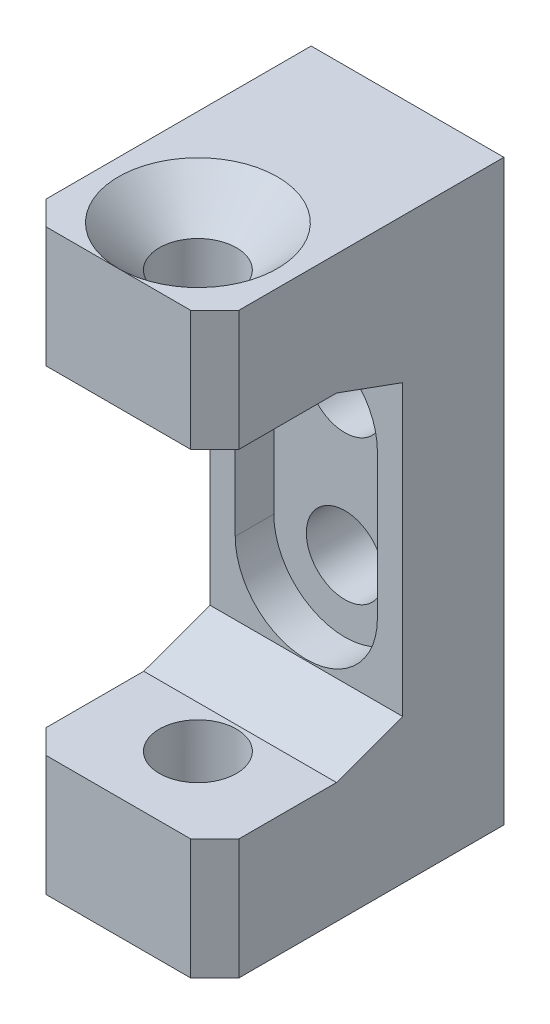
from build123d import *

# Parameters (mm, degrees)
SKETCH_2_W                   = 8
SKETCH_2_H                   = 24
EXTRUDE_1_DEPTH              = 12
SKETCH_3_W                   = 9.180468112
SKETCH_3_H                   = 14
CUT_EXTRUDE_1_DEPTH          = 40
CHAMFER_1_SIZE               = 1
CHAMFER_1_SIZE2              = 2.747477419
HOLE_WIZARD_M3_1_D           = 3.2
HOLE_WIZARD_M3_1_CBORE_D     = 5.9
HOLE_WIZARD_M3_1_CBORE_DEPTH = 1.6
CUT_EXTRUDE_2_DEPTH          = 1.6
HOLE_WIZARD_1767_D           = 3.2
HOLE_WIZARD_1767_DEPTH       = 24
HOLE_WIZARD_1767_CSINK_D     = 6.6
HOLE_WIZARD_1767_CSINK_ANGLE = 90
HOLE_WIZARD_1767_TIP         = 0.96137699
CHAMFER_2_SIZE               = 1


with BuildPart() as part:
    # 草图2 → 凸台-拉伸1 (new body)
    with BuildSketch(Plane.XY):
        with Locations((97, 93)):
            Rectangle(SKETCH_2_W, SKETCH_2_H)
    extrude(amount=EXTRUDE_1_DEPTH)

    # 草图3 → 切除-拉伸1 (cut)
    with BuildSketch(Plane.ZY.offset(-93)):
        with Locations((8.790234056, 93)):
            Rectangle(SKETCH_3_W, SKETCH_3_H)
    extrude(amount=-CUT_EXTRUDE_1_DEPTH, mode=Mode.SUBTRACT)

    # 倒角1
    chamfer_1_edges = [part.edges().sort_by_distance(p)[0] for p in [
        (97, 86, 4.2),
        (97, 100, 4.2),
    ]]
    chamfer_1_side = [part.faces().sort_by_distance(p)[0] for p in [
        (97, 93, 4.2),
    ]]
    chamfer(chamfer_1_edges, length=CHAMFER_1_SIZE, length2=CHAMFER_1_SIZE2, reference=chamfer_1_side[0])

    # M3 六角头螺栓的柱形沉头孔1 (through all)
    with Locations(Plane(origin=(124.363861944, -131.010130877, 4.2), x_dir=(0, 1, 0), z_dir=(0, 0, 1))):
        with Locations((221.010130877, 27.363861944), (227.010130877, 27.363861944)):
            CounterBoreHole(HOLE_WIZARD_M3_1_D / 2, HOLE_WIZARD_M3_1_CBORE_D / 2, HOLE_WIZARD_M3_1_CBORE_DEPTH)

    # 草图11 → 切除-拉伸2 (cut)
    with BuildSketch(Plane.XY.offset(4.2)):
        with BuildLine():
            Line((94.05, 90), (94.05, 96))
            ThreePointArc((94.05, 96), (97, 98.95), (99.95, 96))
            Line((99.95, 96), (99.95, 90))
            ThreePointArc((99.95, 90), (97, 87.05), (94.05, 90))
        make_face()
    extrude(amount=-CUT_EXTRUDE_2_DEPTH, mode=Mode.SUBTRACT)

    # Hole Wizard 1767
    with Locations(Plane(origin=(124.363861944, 105, -5), x_dir=(-1, 0, 0), z_dir=(0, 1, 0))):
        with Locations((27.363861944, 13.7)):
            CounterSinkHole(HOLE_WIZARD_1767_D / 2, HOLE_WIZARD_1767_CSINK_D / 2, depth=HOLE_WIZARD_1767_DEPTH, counter_sink_angle=HOLE_WIZARD_1767_CSINK_ANGLE)
            with Locations((0, 0, -(HOLE_WIZARD_1767_DEPTH + HOLE_WIZARD_1767_TIP / 2))):  # 118° drill point
                Cone(0, HOLE_WIZARD_1767_D / 2, HOLE_WIZARD_1767_TIP, mode=Mode.SUBTRACT)

    # 倒角2
    chamfer_2_edges = [part.edges().sort_by_distance(p)[0] for p in [
        (93, 102.5, 12),
        (101, 102.5, 12),
        (93, 83.5, 12),
        (101, 83.5, 12),
    ]]
    chamfer(chamfer_2_edges, length=CHAMFER_2_SIZE)


solid = part.part
